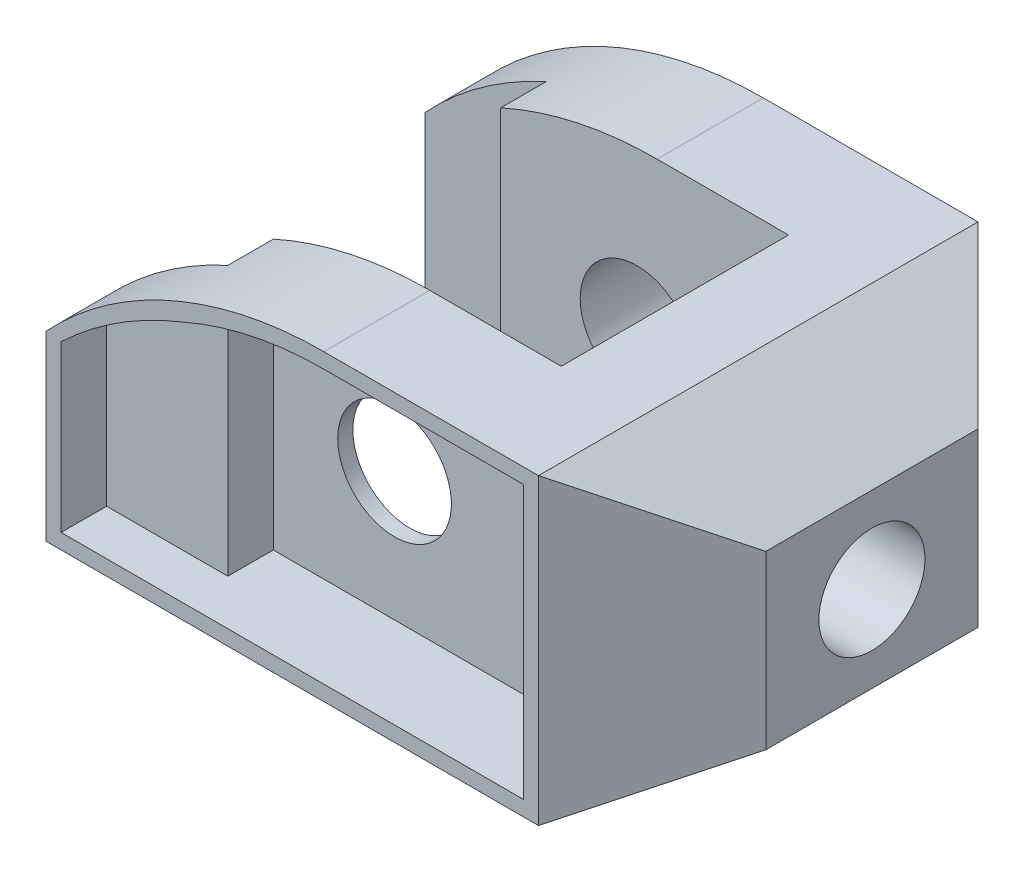
from build123d import *

# Parameters (mm, degrees)
SKETCH1_R               = 7.5
BOSS_EXTRUDE1_DEPTH     = 58
CUT_EXTRUDE1_DEPTH      = 58
CUT_EXTRUDE2_DEPTH      = 58
CUT_EXTRUDE2_DEPTH_BACK = 58
SKETCH5_R               = 7
CUT_EXTRUDE3_DEPTH      = 58
CUT_EXTRUDE14_START     = -12
SKETCH6_R               = 7.5
CUT_EXTRUDE14_DEPTH     = 12
CUT_EXTRUDE15_DEPTH     = 6


with BuildPart() as part:
    # Sketch1 → Boss-Extrude1 (new body)
    with BuildSketch(Plane.XY):
        with BuildLine():
            Line((-34, 5), (-34, -19))
            Line((-34, -19), (31, -19))
            Line((31, -19), (46, -10.339745962))
            Line((46, -10.339745962), (46, 12.339745962))
            Line((46, 12.339745962), (31, 21))
            Line((31, 21), (2.66060556, 21))
            ThreePointArc((2.66060556, 21), (-17.33939444, 16.82575695), (-34, 5))
        make_face()
        with Locations(Location((0, 0, 0), (0, 0, 180))):
            Circle(SKETCH1_R, mode=Mode.SUBTRACT)
    extrude(amount=BOSS_EXTRUDE1_DEPTH)

    # Sketch3 → Cut-Extrude1 (cut)
    with BuildSketch(Plane.XZ.offset(19)):
        Polygon((-34, 50), (-34, 29), (20, 29), (20, 44), (-18, 44), (-18, 50), align=None)
        Polygon((20, 29), (-34, 29), (-34, 8), (-18, 8), (-18, 14), (20, 14), align=None)
    extrude(amount=-CUT_EXTRUDE1_DEPTH, mode=Mode.SUBTRACT)

    # Sketch4 → Cut-Extrude2 (cut, two sides: drawn at the far end of the back side and taken through both)
    with BuildSketch(Plane(origin=(0, 0, 0), x_dir=(1, 0, 0), z_dir=(0, 1, 0)).offset(-CUT_EXTRUDE2_DEPTH_BACK)):
        Polygon((31, -58), (46, -58), (46, -43), align=None)
        Polygon((46, 0), (46, -15), (31, 0), align=None)
    extrude(amount=CUT_EXTRUDE2_DEPTH + CUT_EXTRUDE2_DEPTH_BACK, mode=Mode.SUBTRACT)

    # Sketch5 → Cut-Extrude3 (cut)
    with BuildSketch(Plane(origin=(46, 0, 0), x_dir=(0, 0, -1), z_dir=(1, 0, 0))):
        with Locations(Location((-29, 1, 0), (0, 0, 90))):
            Circle(SKETCH5_R)
    extrude(amount=-CUT_EXTRUDE3_DEPTH, mode=Mode.SUBTRACT)

    # Sketch6 → Cut-Extrude14 (cut)
    # profile 1 of 2: a face of its own
    with BuildSketch(Plane.XY.offset(58).offset(CUT_EXTRUDE14_START)):
        with BuildLine():
            Line((29, 19), (2.646901018, 19))
            ThreePointArc((2.646901018, 19), (-6.883325567, 18.001943013), (-16, 15.051081475))
            Line((-16, 15.051081475), (-16, -17))
            Line((-16, -17), (29, -17))
            Line((29, -17), (29, 19))
        make_face()
        with Locations(Location((0, 0, 0), (0, 0, 180))):
            Circle(SKETCH6_R, mode=Mode.SUBTRACT)
    # profile 2 of 2: a face of its own
    with BuildSketch(Plane.XY.offset(58).offset(CUT_EXTRUDE14_START)):
        with Locations(Location((0, 0, 0), (0, 0, 180))):
            Circle(SKETCH6_R)
    extrude(amount=CUT_EXTRUDE14_DEPTH, mode=Mode.SUBTRACT)

    # Sketch7 → Cut-Extrude15 (cut)
    with BuildSketch(Plane.XY.offset(58)):
        with BuildLine():
            Line((-16, -17), (-32, -17))
            Line((-32, -17), (-32, 4.802151126))
            ThreePointArc((-32, 4.802151126), (-24.496853388, 10.702273265), (-16, 15.051081475))
            Line((-16, 15.051081475), (-16, -17))
        make_face()
    extrude(amount=-CUT_EXTRUDE15_DEPTH, mode=Mode.SUBTRACT)


solid = part.part
